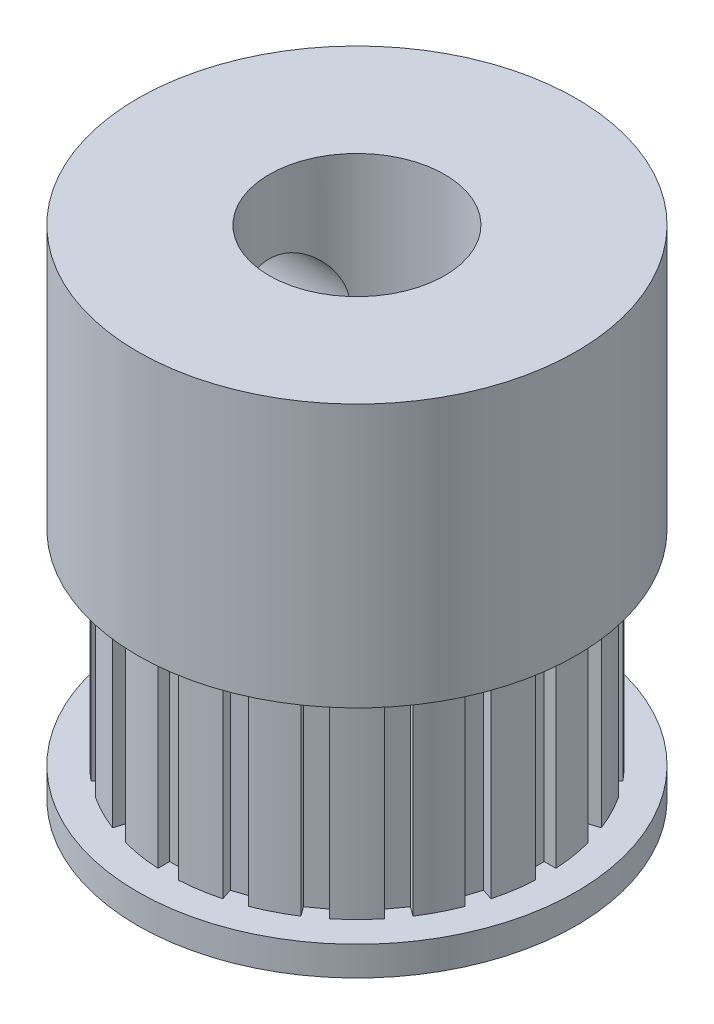
from build123d import *

# Parameters (mm, degrees)
SKETCH_1_R               = 7.5
EXTRUDE_1_DEPTH          = 1
EXTRUDE_2_DEPTH          = 7
SKETCH_3_R               = 7.5
EXTRUDE_3_DEPTH          = 9
CUT_EXTRUDE_1_REACH      = 22.037
SKETCH_4_R               = 3
CUT_EXTRUDE_2_REACH      = 22.037
CUT_EXTRUDE_2_END_RADIUS = 7.5
SKETCH_5_R               = 2


with BuildPart() as part:
    # 草图1 → 凸台-拉伸1 (new body)
    with BuildSketch(Plane(origin=(0, 0, 0), x_dir=(1, 0, 0), z_dir=(0, 1, 0))):
        with Locations(Location((0, 0, 0), (0, 0, 270))):
            Circle(SKETCH_1_R)
    extrude(amount=EXTRUDE_1_DEPTH)

    # 草图2 → 凸台-拉伸2 (add)
    with BuildSketch(Plane(origin=(0, 1, 0), x_dir=(1, 0, 0), z_dir=(0, 1, 0))):
        with BuildLine():
            Line((-0.35, 6.055518957), (-0.35, 6.455518957))
            ThreePointArc((-0.35, 6.455518957), (-1.011348816, 6.385405122), (-1.661995284, 6.247719318))
            Line((-1.661995284, 6.247719318), (-1.538388487, 5.867296711))
            Line((-1.538388487, 5.867296711), (-2.204128048, 5.650984815))
            Line((-2.204128048, 5.650984815), (-2.327734846, 6.031407422))
            ThreePointArc((-2.327734846, 6.031407422), (-2.935048581, 5.760357179), (-3.511302891, 5.428349382))
            Line((-3.511302891, 5.428349382), (-3.27618879, 5.104742584))
            Line((-3.27618879, 5.104742584), (-3.842500686, 4.693292907))
            Line((-3.842500686, 4.693292907), (-4.077614787, 5.016899705))
            ThreePointArc((-4.077614787, 5.016899705), (-4.57144534, 4.57144534), (-5.016899705, 4.077614787))
            Line((-5.016899705, 4.077614787), (-4.693292907, 3.842500686))
            Line((-4.693292907, 3.842500686), (-5.104742584, 3.27618879))
            Line((-5.104742584, 3.27618879), (-5.428349382, 3.511302891))
            ThreePointArc((-5.428349382, 3.511302891), (-5.760357179, 2.935048581), (-6.031407422, 2.327734846))
            Line((-6.031407422, 2.327734846), (-5.650984815, 2.204128048))
            Line((-5.650984815, 2.204128048), (-5.867296711, 1.538388487))
            Line((-5.867296711, 1.538388487), (-6.247719318, 1.661995284))
            ThreePointArc((-6.247719318, 1.661995284), (-6.385405122, 1.011348816), (-6.455518957, 0.35))
            Line((-6.455518957, 0.35), (-6.055518957, 0.35))
            Line((-6.055518957, 0.35), (-6.055518957, -0.35))
            Line((-6.055518957, -0.35), (-6.455518957, -0.35))
            ThreePointArc((-6.455518957, -0.35), (-6.385405122, -1.011348816), (-6.247719318, -1.661995284))
            Line((-6.247719318, -1.661995284), (-5.867296711, -1.538388487))
            Line((-5.867296711, -1.538388487), (-5.650984815, -2.204128048))
            Line((-5.650984815, -2.204128048), (-6.031407422, -2.327734846))
            ThreePointArc((-6.031407422, -2.327734846), (-5.760357179, -2.935048581), (-5.428349382, -3.511302891))
            Line((-5.428349382, -3.511302891), (-5.104742584, -3.27618879))
            Line((-5.104742584, -3.27618879), (-4.693292907, -3.842500686))
            Line((-4.693292907, -3.842500686), (-5.016899705, -4.077614787))
            ThreePointArc((-5.016899705, -4.077614787), (-4.57144534, -4.57144534), (-4.077614787, -5.016899705))
            Line((-4.077614787, -5.016899705), (-3.842500686, -4.693292907))
            Line((-3.842500686, -4.693292907), (-3.27618879, -5.104742584))
            Line((-3.27618879, -5.104742584), (-3.511302891, -5.428349382))
            ThreePointArc((-3.511302891, -5.428349382), (-2.935048581, -5.760357179), (-2.327734846, -6.031407422))
            Line((-2.327734846, -6.031407422), (-2.204128048, -5.650984815))
            Line((-2.204128048, -5.650984815), (-1.538388487, -5.867296711))
            Line((-1.538388487, -5.867296711), (-1.661995284, -6.247719318))
            ThreePointArc((-1.661995284, -6.247719318), (-1.011348816, -6.385405122), (-0.35, -6.455518957))
            Line((-0.35, -6.455518957), (-0.35, -6.055518957))
            Line((-0.35, -6.055518957), (0.35, -6.055518957))
            Line((0.35, -6.055518957), (0.35, -6.455518957))
            ThreePointArc((0.35, -6.455518957), (1.011348816, -6.385405122), (1.661995284, -6.247719318))
            Line((1.661995284, -6.247719318), (1.538388487, -5.867296711))
            Line((1.538388487, -5.867296711), (2.204128048, -5.650984815))
            Line((2.204128048, -5.650984815), (2.327734846, -6.031407422))
            ThreePointArc((2.327734846, -6.031407422), (2.935048581, -5.760357179), (3.511302891, -5.428349382))
            Line((3.511302891, -5.428349382), (3.27618879, -5.104742584))
            Line((3.27618879, -5.104742584), (3.842500686, -4.693292907))
            Line((3.842500686, -4.693292907), (4.077614787, -5.016899705))
            ThreePointArc((4.077614787, -5.016899705), (4.57144534, -4.57144534), (5.016899705, -4.077614787))
            Line((5.016899705, -4.077614787), (4.693292907, -3.842500686))
            Line((4.693292907, -3.842500686), (5.104742584, -3.27618879))
            Line((5.104742584, -3.27618879), (5.428349382, -3.511302891))
            ThreePointArc((5.428349382, -3.511302891), (5.760357179, -2.935048581), (6.031407422, -2.327734846))
            Line((6.031407422, -2.327734846), (5.650984815, -2.204128048))
            Line((5.650984815, -2.204128048), (5.867296711, -1.538388487))
            Line((5.867296711, -1.538388487), (6.247719318, -1.661995284))
            ThreePointArc((6.247719318, -1.661995284), (6.385405122, -1.011348816), (6.455518957, -0.35))
            Line((6.455518957, -0.35), (6.055518957, -0.35))
            Line((6.055518957, -0.35), (6.055518957, 0.35))
            Line((6.055518957, 0.35), (6.455518957, 0.35))
            ThreePointArc((6.455518957, 0.35), (6.385405122, 1.011348816), (6.247719318, 1.661995284))
            Line((6.247719318, 1.661995284), (5.867296711, 1.538388487))
            Line((5.867296711, 1.538388487), (5.650984815, 2.204128048))
            Line((5.650984815, 2.204128048), (6.031407422, 2.327734846))
            ThreePointArc((6.031407422, 2.327734846), (5.760357179, 2.935048581), (5.428349382, 3.511302891))
            Line((5.428349382, 3.511302891), (5.104742584, 3.27618879))
            Line((5.104742584, 3.27618879), (4.693292907, 3.842500686))
            Line((4.693292907, 3.842500686), (5.016899705, 4.077614787))
            ThreePointArc((5.016899705, 4.077614787), (4.57144534, 4.57144534), (4.077614787, 5.016899705))
            Line((4.077614787, 5.016899705), (3.842500686, 4.693292907))
            Line((3.842500686, 4.693292907), (3.27618879, 5.104742584))
            Line((3.27618879, 5.104742584), (3.511302891, 5.428349382))
            ThreePointArc((3.511302891, 5.428349382), (2.935048581, 5.760357179), (2.327734846, 6.031407422))
            Line((2.327734846, 6.031407422), (2.204128048, 5.650984815))
            Line((2.204128048, 5.650984815), (1.538388487, 5.867296711))
            Line((1.538388487, 5.867296711), (1.661995284, 6.247719318))
            ThreePointArc((1.661995284, 6.247719318), (1.011348816, 6.385405122), (0.35, 6.455518957))
            Line((0.35, 6.455518957), (0.35, 6.055518957))
            Line((0.35, 6.055518957), (-0.35, 6.055518957))
        make_face()
    extrude(amount=EXTRUDE_2_DEPTH)

    # 草图3 → 凸台-拉伸3 (add)
    with BuildSketch(Plane(origin=(0, 8, 0), x_dir=(1, 0, 0), z_dir=(0, 1, 0))):
        with Locations(Location((0, 0, 0), (0, 0, 270))):
            Circle(SKETCH_3_R)
    extrude(amount=EXTRUDE_3_DEPTH)

    # 草图4 → 切除-拉伸1 (cut, up to next)
    with BuildSketch(Plane(origin=(0, 17, 0), x_dir=(1, 0, 0), z_dir=(0, 1, 0)), mode=Mode.PRIVATE) as cut_extrude_1_sk1:
        with Locations(Location((0, 0, 0), (0, 0, 270))):
            Circle(SKETCH_4_R)
    cut_extrude_1_tool1 = extrude(cut_extrude_1_sk1.sketch, amount=-CUT_EXTRUDE_1_REACH, mode=Mode.PRIVATE) & part.part
    add(cut_extrude_1_tool1.solids().sort_by_distance((0, 17, 0))[0], mode=Mode.SUBTRACT)

    # 切除-拉伸2: up to this cylinder (the profile starts inside it)
    cut_extrude_2_end = Plane(origin=(0, 12.5, 0), z_dir=(0, -1, 0)) * Cylinder(CUT_EXTRUDE_2_END_RADIUS, 60.074, mode=Mode.PRIVATE)
    # 草图5 → 切除-拉伸2 (cut, up to the surface)
    with BuildSketch(Plane(origin=(0, 0, 0), x_dir=(0, 0, -1), z_dir=(1, 0, 0)), mode=Mode.PRIVATE) as cut_extrude_2_sk1:
        with Locations((0, 12.5)):
            Circle(SKETCH_5_R)
    cut_extrude_2_tool1 = extrude(cut_extrude_2_sk1.sketch, amount=-CUT_EXTRUDE_2_REACH, mode=Mode.PRIVATE) & cut_extrude_2_end
    add(cut_extrude_2_tool1.solids().sort_by_distance((0, 12.5, 0))[0], mode=Mode.SUBTRACT)


solid = part.part
